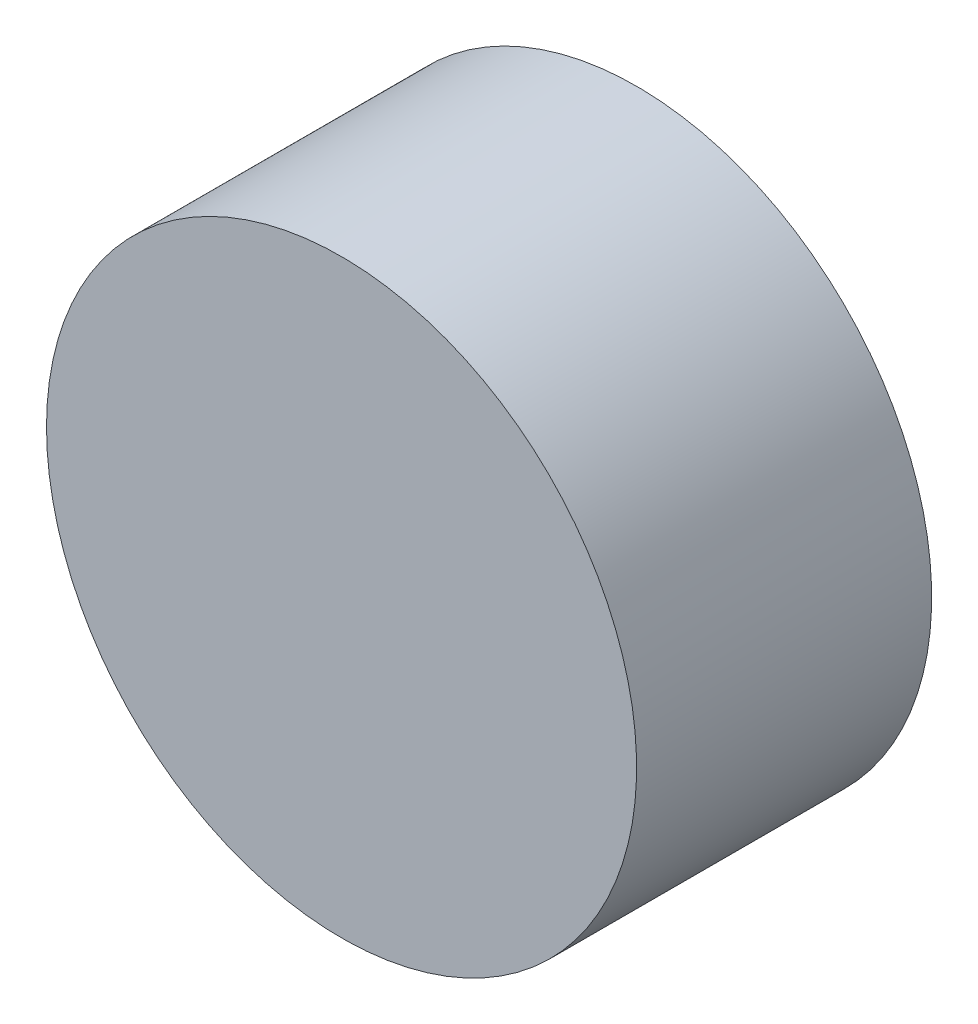
from build123d import *

# Parameters (mm, degrees)
SKETCH1_W = 10
SKETCH1_H = 10


with BuildPart() as part:
    # Sketch1 → Revolve1 (revolve)
    with BuildSketch(Plane.XZ, mode=Mode.PRIVATE) as revolve1_sk:
        with Locations((5, 5)):
            Rectangle(SKETCH1_W, SKETCH1_H)
    revolve(revolve1_sk.sketch.rotate(Axis((0, 0, 10), (0, 0, -1)), 180), axis=Axis((0, 0, 10), (0, 0, -1)))


solid = part.part
